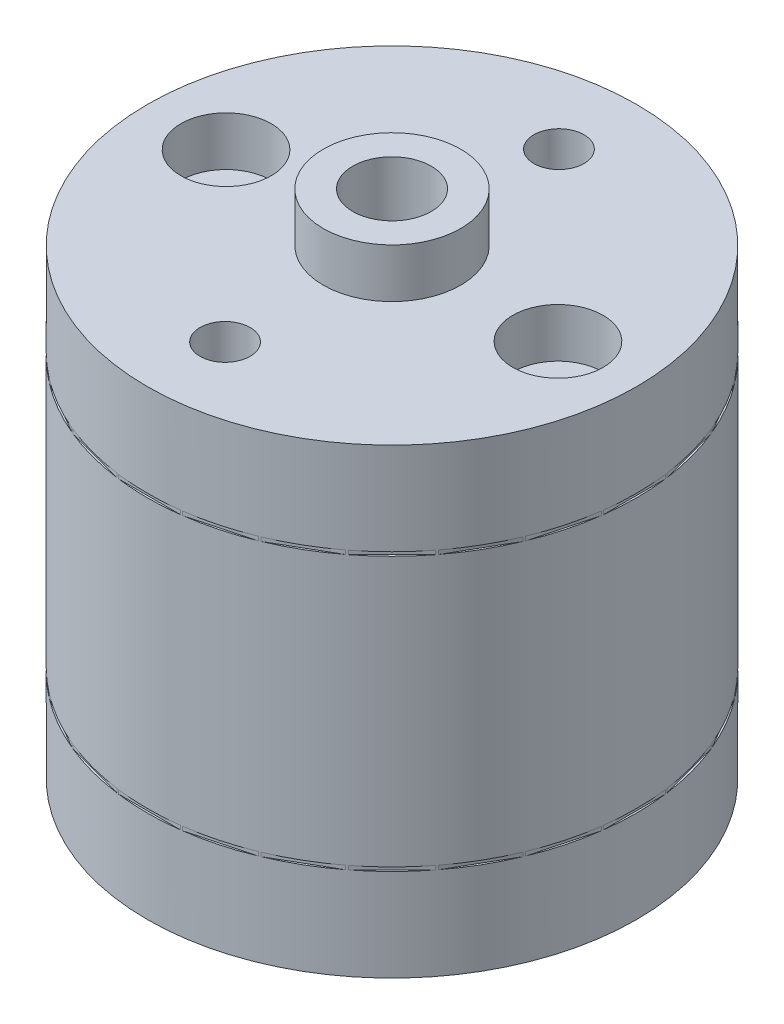
from build123d import *

# Parameters (mm, degrees)
CROQUIS1_R              = 12.45
SALIENTE_EXTRUIR1_DEPTH = 23.5
CROQUIS2_W              = 24.9
CROQUIS2_H              = 0.2
CORTAR_EXTRUIR1_DEPTH   = 0.1
MATRIZC1_COUNT          = 24
CROQUIS5_R              = 3.5
SALIENTE_EXTRUIR2_DEPTH = 2.5
CROQUIS6_R              = 2
CORTAR_EXTRUIR3_DEPTH   = 32.400716552
CROQUIS7_R              = 1.275
CROQUIS7_R_2            = 2.3
CORTAR_EXTRUIR4_DEPTH   = 2.5


with BuildPart() as part:
    # Croquis1 → Saliente-Extruir1 (new body)
    with BuildSketch(Plane(origin=(0, 0, 0), x_dir=(1, 0, 0), z_dir=(0, 1, 0))):
        with Locations(Location((0, 0, 0), (0, 0, 270))):
            Circle(CROQUIS1_R)
    extrude(amount=SALIENTE_EXTRUIR1_DEPTH)

    # Croquis2 → Cortar-Extruir1 (cut)
    with BuildSketch(Plane.XY.offset(12.45)):
        with Locations((0, 18.7)):
            Rectangle(CROQUIS2_W, CROQUIS2_H)
        with Locations((0, 4.8)):
            Rectangle(CROQUIS2_W, CROQUIS2_H)
    cortar_extruir1 = extrude(amount=-CORTAR_EXTRUIR1_DEPTH, mode=Mode.SUBTRACT)

    # MatrizC1: Cortar-Extruir1 ×24 about axis
    matrizc1_axis = Axis((0, 0, 0), (0, 1, 0))
    for i in range(1, MATRIZC1_COUNT):
        add(cortar_extruir1.rotate(matrizc1_axis, i * 360 / MATRIZC1_COUNT), mode=Mode.SUBTRACT)

    # Croquis5 → Saliente-Extruir2 (add)
    with BuildSketch(Plane(origin=(0, 23.5, 0), x_dir=(1, 0, 0), z_dir=(0, 1, 0))):
        with Locations(Location((0, 0, 0), (0, 0, 270))):
            Circle(CROQUIS5_R)
    extrude(amount=SALIENTE_EXTRUIR2_DEPTH)

    # Croquis6 → Cortar-Extruir3 (cut, through all)
    with BuildSketch(Plane(origin=(0, 26, 0), x_dir=(1, 0, 0), z_dir=(0, 1, 0))):
        with Locations(Location((0, 0, 0), (0, 0, 270))):
            Circle(CROQUIS6_R)
    extrude(amount=-CORTAR_EXTRUIR3_DEPTH, mode=Mode.SUBTRACT)

    # Croquis7 → Cortar-Extruir4 (cut)
    with BuildSketch(Plane(origin=(0, 23.5, 0), x_dir=(1, 0, 0), z_dir=(0, 1, 0))):
        with Locations(Location((0, 8.5, 0), (0, 0, 270))):
            Circle(CROQUIS7_R)
        with Locations(Location((0, -8.5, 0), (0, 0, 90))):
            Circle(CROQUIS7_R)
        with Locations(Location((-8.45, 0, 0), (0, 0, 270))):
            Circle(CROQUIS7_R_2)
        with Locations(Location((8.45, 0, 0), (0, 0, 90))):
            Circle(CROQUIS7_R_2)
    extrude(amount=-CORTAR_EXTRUIR4_DEPTH, mode=Mode.SUBTRACT)


solid = part.part
